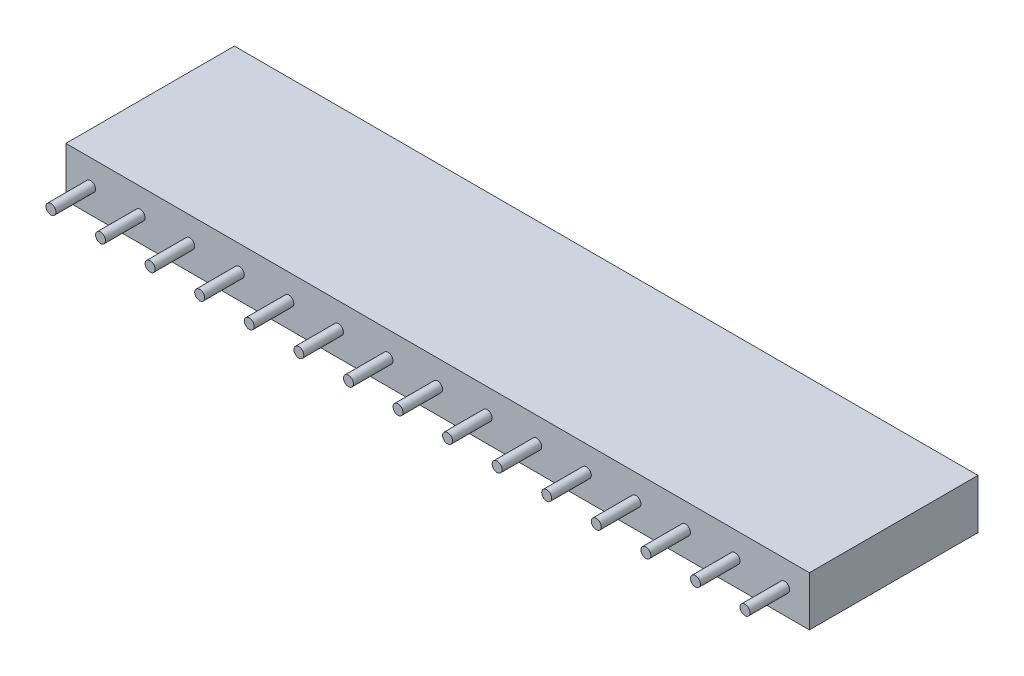
from build123d import *

# Parameters (mm, degrees)
ESQUISSE1_W                = 2.5
ESQUISSE1_H                = 2.5
BOSS_EXTRU_1_DEPTH         = 8.5
ESQUISSE2_R                = 0.25
BOSS_EXTRU_2_DEPTH         = 2
ESQUISSE3_R                = 0.25
ENL_V_MAT_EXTRU_2_DEPTH    = 4
R_P_TITION_LIN_AIRE1_COUNT = 15
R_P_TITION_LIN_AIRE1_PITCH = 2.5


with BuildPart() as part:
    # Esquisse1 → Boss.-Extru.1 (new body)
    with BuildSketch(Plane.XY):
        with Locations((-1.25, 1.25)):
            Rectangle(ESQUISSE1_W, ESQUISSE1_H)
    boss_extru_1 = extrude(amount=BOSS_EXTRU_1_DEPTH)

    # Esquisse2 → Boss.-Extru.2 (add)
    with BuildSketch(Plane.XY.offset(8.5)):
        with Locations((-1.25, 1.25)):
            Circle(ESQUISSE2_R)
    boss_extru_2 = extrude(amount=BOSS_EXTRU_2_DEPTH)

    # Esquisse3 → Enlèv. mat.-Extru.2 (cut)
    with BuildSketch(Plane(origin=(0, 0, 0), x_dir=(-1, 0, 0), z_dir=(0, 0, -1))):
        with Locations(Location((1.25, 1.25, 0), (0, 0, 180))):
            Circle(ESQUISSE3_R)
    enl_v_mat_extru_2 = extrude(amount=-ENL_V_MAT_EXTRU_2_DEPTH, mode=Mode.SUBTRACT)

    # Répétition linéaire1: Boss.-Extru.1, Boss.-Extru.2, Enlèv. mat.-Extru.2 ×15
    with Locations(*[(-i * R_P_TITION_LIN_AIRE1_PITCH, 0, 0) for i in range(1, R_P_TITION_LIN_AIRE1_COUNT)]):
        add(boss_extru_1)
        add(boss_extru_2)
        add(enl_v_mat_extru_2, mode=Mode.SUBTRACT)


solid = part.part
